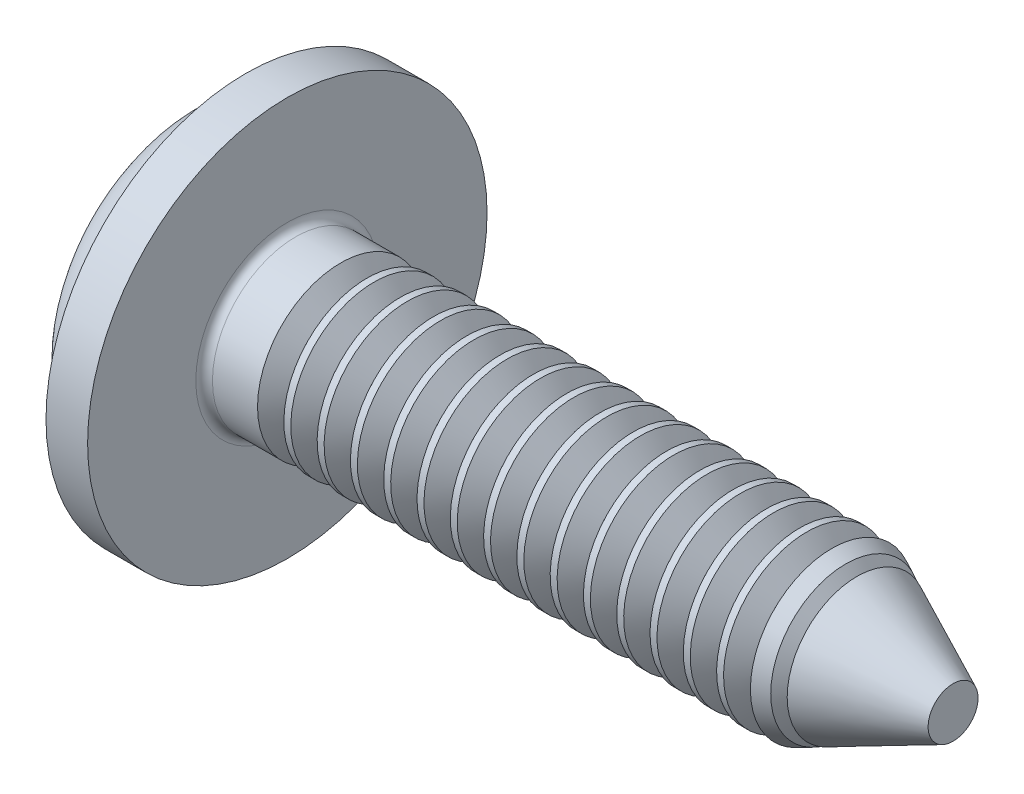
from build123d import *

# Parameters (mm, degrees)
FILLET1_R                = 0.1
RECPAT_COUNT             = 2
RECPAT_ANGLE             = 90
THDSCHPAT_COUNT          = 19
THDSCHPAT_PITCH          = 0.4
ESBO_O1_R                = 2.4
RESSALTO_EXTRUS_O1_DEPTH = 0.5
SCALE1_SCALE             = 0.8


with BuildPart() as part:
    # BodySke → Base-Revolve (revolve)
    with BuildSketch(Plane.XY, mode=Mode.PRIVATE) as base_revolve_sk:
        with BuildLine():
            Line((1.6, 1), (1.6, 2))
            Line((1.6, 2), (1.1, 2))
            ThreePointArc((1.1, 2), (0.688403396, 1.885994341), (0.394117647, 1.576470588))
            ThreePointArc((0.394117647, 1.576470588), (0.100022625, 0.812494344), (0, 0))
            Line((0, 0), (9.6, 0))
            Line((9.6, 0), (9.6, 1))
            Line((9.6, 1), (1.6, 1))
        make_face()
    revolve(base_revolve_sk.sketch.rotate(Axis((1.1, 0, 0), (1, 0, 0)), 90), axis=Axis((1.1, 0, 0), (1, 0, 0)))

    # Fillet1
    fillet1_edges = [part.edges().sort_by_distance(p)[0] for p in [
        (1.6, 0, -1),
    ]]
    fillet(fillet1_edges, radius=FILLET1_R)

    # Sketch3 → Recess section 0
    with BuildSketch(Plane(origin=(0, 0, 0), x_dir=(0, 0, -1), z_dir=(1, 0, 0))):
        with BuildLine():
            Line((0.24, -1.05), (-0.24, -1.05))
            Line((-0.24, -1.05), (-0.24, 1.05))
            Line((-0.24, 1.05), (0.24, 1.05))
            Line((0.24, 1.05), (0.24, -1.05))
        make_face()
    # Sketch4 → Recess section 1
    with BuildSketch(Plane(origin=(1.42, 0, 0), x_dir=(0, 0, -1), z_dir=(1, 0, 0))):
        with BuildLine():
            Line((0.24, -0.342014235), (-0.24, -0.342014235))
            Line((-0.24, -0.342014235), (-0.24, 0.342014235))
            Line((-0.24, 0.342014235), (0.24, 0.342014235))
            Line((0.24, 0.342014235), (0.24, -0.342014235))
        make_face()
    recess = loft(mode=Mode.SUBTRACT)

    # RecPat: Recess ×2 about axis
    recpat_axis = Axis((0, 0, 0), (1, 0, 0))
    for i in range(1, RECPAT_COUNT):
        add(recess.rotate(recpat_axis, i * RECPAT_ANGLE / (RECPAT_COUNT - 1)), mode=Mode.SUBTRACT)

    # RecCorSke → RecessCore (revolve, cut)
    with BuildSketch(Plane.XY, mode=Mode.PRIVATE) as recesscore_sk:
        Polygon((0, 0), (0, 0.454796073), (1.42, 0.3555), (1.535508952, 0), align=None)
    revolve(recesscore_sk.sketch.rotate(Axis((-3.175, 0, 0), (1, 0, 0)), 13.849905977), axis=Axis((-3.175, 0, 0), (1, 0, 0)), mode=Mode.SUBTRACT)

    # ThdSchSke → ThreadSchematic (revolve, cut)
    with BuildSketch(Plane.XY, mode=Mode.PRIVATE) as threadschematic_sk:
        Polygon((2.4, -0.774), (2.241753096, -1), (2.241753096, -1.25), (2.558246904, -1.25), (2.558246904, -1), align=None)
    threadschematic = revolve(threadschematic_sk.sketch.rotate(Axis((-3.175, 0, 0), (1, 0, 0)), 270), axis=Axis((-3.175, 0, 0), (1, 0, 0)), mode=Mode.SUBTRACT)

    # ThdSchPat: ThreadSchematic ×19
    with Locations(*[(i * THDSCHPAT_PITCH, 0, 0) for i in range(1, THDSCHPAT_COUNT)]):
        add(threadschematic, mode=Mode.SUBTRACT)

    # Esboço1 → Ressalto-extrusão1 (add)
    with BuildSketch(Plane(origin=(1.6, 0, 0), x_dir=(0, 0, -1), z_dir=(1, 0, 0))):
        Circle(ESBO_O1_R)
    extrude(amount=-RESSALTO_EXTRUS_O1_DEPTH)

    # Esboço2 → Corte-Revolução1 (revolve, cut)
    with BuildSketch(Plane(origin=(0, 0, 0), x_dir=(1, 0, 0), z_dir=(0, 1, 0)), mode=Mode.PRIVATE) as corte_revolu_o1_sk:
        Polygon((9.6, 0.3), (8.1, 1), (9.6, 1), align=None)
    revolve(corte_revolu_o1_sk.sketch.rotate(Axis((0, 0, 0), (1, 0, 0)), 270), axis=Axis((0, 0, 0), (1, 0, 0)), mode=Mode.SUBTRACT)


with BuildPart() as part_1:
    # Scale1: scaled about (3.259576081, 1.9e-08, -1.5e-08)
    add(part.part.scale(SCALE1_SCALE).moved(Location((0.651915216, 4e-09, -3e-09))))


solid = part_1.part
